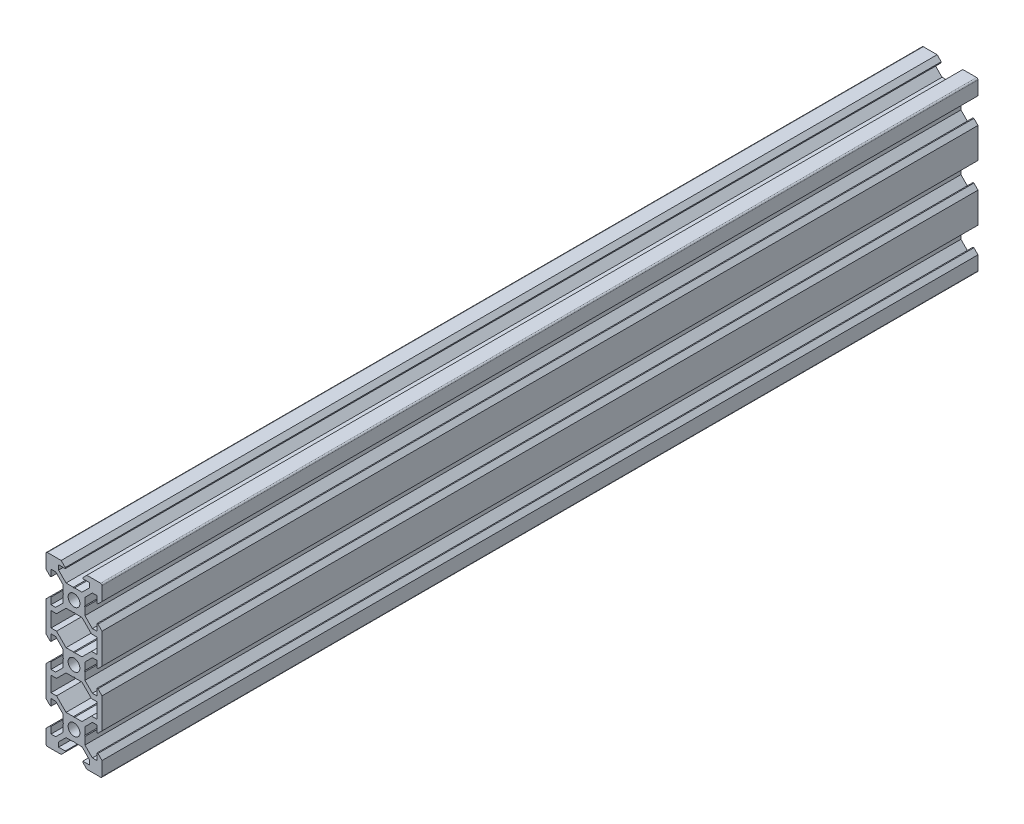
from build123d import *

# Parameters (mm, degrees)
BOSS_EXTRU_1_DEPTH = 312.76


with BuildPart() as part:
    # Esquisse1 → Boss.-Extru.1 (new body)
    with BuildSketch(Plane.XY):
        with BuildLine():
            Line((-9.5, 10), (-4.58, 10))
            Line((-4.58, 10), (-3.125, 8.545))
            Line((-3.125, 8.545), (-3.125, 8.2))
            Line((-3.125, 8.2), (-5.5, 8.2))
            Line((-5.5, 8.2), (-5.5, 6.560660172))
            Line((-5.5, 6.560660172), (-2.839339828, 3.9))
            Line((-2.839339828, 3.9), (-0.21, 3.9))
            Line((-0.21, 3.9), (0, 3.69))
            Line((0, 3.69), (0, 2.1))
            ThreePointArc((0, 2.1), (-2.1, 0), (0, -2.1))
            Line((0, -2.1), (0, -3.69))
            Line((0, -3.69), (-0.21, -3.9))
            Line((-0.21, -3.9), (-2.839339828, -3.9))
            Line((-2.839339828, -3.9), (-6.239339828, -7.3))
            Line((-6.239339828, -7.3), (-8.2, -7.3))
            Line((-8.2, -7.3), (-8.2, -12.7))
            Line((-8.2, -12.7), (-6.239339828, -12.7))
            Line((-6.239339828, -12.7), (-2.839339828, -16.1))
            Line((-2.839339828, -16.1), (-0.21, -16.1))
            Line((-0.21, -16.1), (0, -16.31))
            Line((0, -16.31), (0, -17.9))
            ThreePointArc((0, -17.9), (-2.1, -20), (0, -22.1))
            Line((0, -22.1), (0, -23.69))
            Line((0, -23.69), (-0.21, -23.9))
            Line((-0.21, -23.9), (-2.839339828, -23.9))
            Line((-2.839339828, -23.9), (-6.239339828, -27.3))
            Line((-6.239339828, -27.3), (-8.2, -27.3))
            Line((-8.2, -27.3), (-8.2, -32.7))
            Line((-8.2, -32.7), (-6.239339828, -32.7))
            Line((-6.239339828, -32.7), (-2.839339828, -36.1))
            Line((-2.839339828, -36.1), (-0.21, -36.1))
            Line((-0.21, -36.1), (0, -36.31))
            Line((0, -36.31), (0, -37.9))
            ThreePointArc((0, -37.9), (-2.1, -40), (0, -42.1))
            Line((0, -42.1), (0, -43.69))
            Line((0, -43.69), (-0.21, -43.9))
            Line((-0.21, -43.9), (-2.839339828, -43.9))
            Line((-2.839339828, -43.9), (-5.5, -46.560660172))
            Line((-5.5, -46.560660172), (-5.5, -48.2))
            Line((-5.5, -48.2), (-3.125, -48.2))
            Line((-3.125, -48.2), (-3.125, -48.545))
            Line((-3.125, -48.545), (-4.58, -50))
            Line((-4.58, -50), (-9.5, -50))
            ThreePointArc((-9.5, -50), (-9.853553391, -49.853553391), (-10, -49.5))
            Line((-10, -49.5), (-10, -44.58))
            Line((-10, -44.58), (-8.545, -43.125))
            Line((-8.545, -43.125), (-8.2, -43.125))
            Line((-8.2, -43.125), (-8.2, -45.5))
            Line((-8.2, -45.5), (-6.560660172, -45.5))
            Line((-6.560660172, -45.5), (-3.9, -42.839339828))
            Line((-3.9, -42.839339828), (-3.9, -40.21))
            Line((-3.9, -40.21), (-3.69, -40))
            Line((-3.69, -40), (-3.9, -39.79))
            Line((-3.9, -39.79), (-3.9, -37.160660172))
            Line((-3.9, -37.160660172), (-6.560660172, -34.5))
            Line((-6.560660172, -34.5), (-8.2, -34.5))
            Line((-8.2, -34.5), (-8.2, -36.875))
            Line((-8.2, -36.875), (-8.545, -36.875))
            Line((-8.545, -36.875), (-10, -35.42))
            Line((-10, -35.42), (-10, -24.58))
            Line((-10, -24.58), (-8.545, -23.125))
            Line((-8.545, -23.125), (-8.2, -23.125))
            Line((-8.2, -23.125), (-8.2, -25.5))
            Line((-8.2, -25.5), (-6.560660172, -25.5))
            Line((-6.560660172, -25.5), (-3.9, -22.839339828))
            Line((-3.9, -22.839339828), (-3.9, -20.21))
            Line((-3.9, -20.21), (-3.69, -20))
            Line((-3.69, -20), (-3.9, -19.79))
            Line((-3.9, -19.79), (-3.9, -17.160660172))
            Line((-3.9, -17.160660172), (-6.560660172, -14.5))
            Line((-6.560660172, -14.5), (-8.2, -14.5))
            Line((-8.2, -14.5), (-8.2, -16.875))
            Line((-8.2, -16.875), (-8.545, -16.875))
            Line((-8.545, -16.875), (-10, -15.42))
            Line((-10, -15.42), (-10, -4.58))
            Line((-10, -4.58), (-8.545, -3.125))
            Line((-8.545, -3.125), (-8.2, -3.125))
            Line((-8.2, -3.125), (-8.2, -5.5))
            Line((-8.2, -5.5), (-6.560660172, -5.5))
            Line((-6.560660172, -5.5), (-3.9, -2.839339828))
            Line((-3.9, -2.839339828), (-3.9, -0.21))
            Line((-3.9, -0.21), (-3.69, 0))
            Line((-3.69, 0), (-3.9, 0.21))
            Line((-3.9, 0.21), (-3.9, 2.839339828))
            Line((-3.9, 2.839339828), (-6.560660172, 5.5))
            Line((-6.560660172, 5.5), (-8.2, 5.5))
            Line((-8.2, 5.5), (-8.2, 3.125))
            Line((-8.2, 3.125), (-8.545, 3.125))
            Line((-8.545, 3.125), (-10, 4.58))
            Line((-10, 4.58), (-10, 9.5))
            ThreePointArc((-10, 9.5), (-9.853553391, 9.853553391), (-9.5, 10))
        make_face()
    boss_extru_1 = extrude(amount=BOSS_EXTRU_1_DEPTH)

    # Symétrie1: Boss.-Extru.1 across plane
    add(boss_extru_1.mirror(Plane(origin=(0, 3.69, 312.76), x_dir=(0, 0, 1), z_dir=(-1, 0, 0))))


solid = part.part
